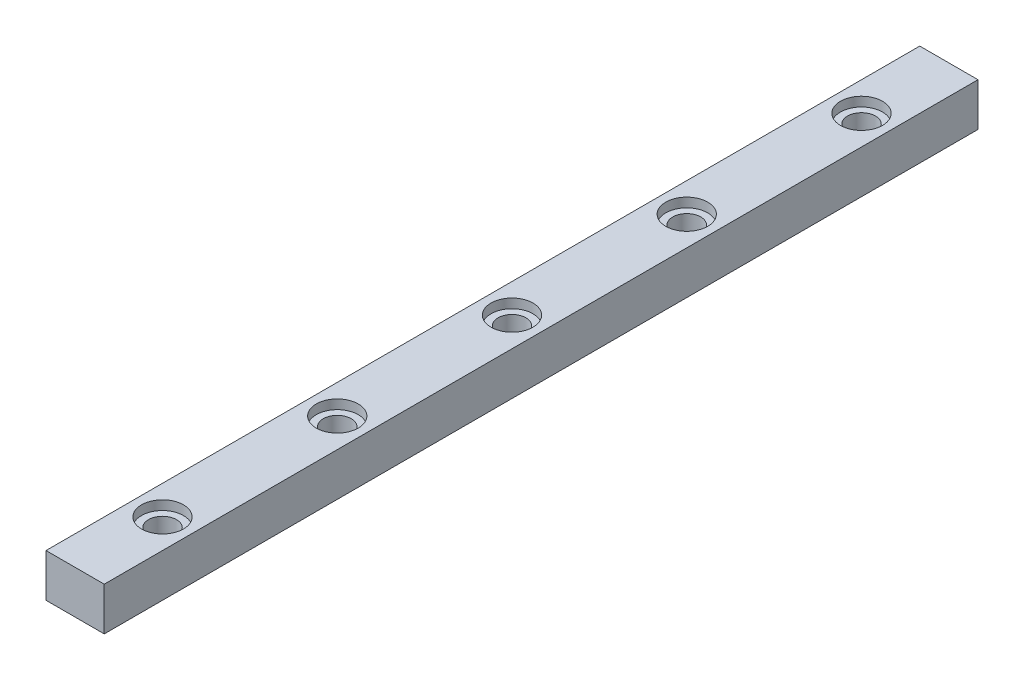
from build123d import *

# Parameters (mm, degrees)
SKETCH_1_W             = 5
SKETCH_1_H             = 3.7
EXTRUDE_1_DEPTH        = 37.5
SKETCH_2_R             = 1.2
CUT_EXTRUDE_1_DEPTH    = 3010.5
SKETCH_3_R             = 1.8
CUT_EXTRUDE_2_DEPTH    = 0.8
PATTERN_LINEAR_1_COUNT = 5
PATTERN_LINEAR_1_PITCH = 15


with BuildPart() as part:
    # 草图1 → 凸台-拉伸1 (new, symmetric)
    with BuildSketch(Plane.XY):
        Rectangle(SKETCH_1_W, SKETCH_1_H)
    extrude(amount=EXTRUDE_1_DEPTH, both=True)

    # 草图2 → 切除-拉伸1 (cut, symmetric)
    with BuildSketch(Plane(origin=(0, 1.85, 0), x_dir=(1, 0, 0), z_dir=(0, 1, 0))):
        with Locations(Location((0, -30, 0), (0, 0, 270))):
            Circle(SKETCH_2_R)
    cut_extrude_1 = extrude(amount=CUT_EXTRUDE_1_DEPTH, both=True, mode=Mode.SUBTRACT)

    # 草图3 → 切除-拉伸2 (cut)
    with BuildSketch(Plane(origin=(0, 1.85, 0), x_dir=(1, 0, 0), z_dir=(0, 1, 0))):
        with Locations(Location((0, -30, 0), (0, 0, 270))):
            Circle(SKETCH_3_R)
    cut_extrude_2 = extrude(amount=-CUT_EXTRUDE_2_DEPTH, mode=Mode.SUBTRACT)

    # 阵列(线性)1: 切除-拉伸1, 切除-拉伸2 ×5
    with Locations(*[(0, 0, -i * PATTERN_LINEAR_1_PITCH) for i in range(1, PATTERN_LINEAR_1_COUNT)]):
        add(cut_extrude_1, mode=Mode.SUBTRACT)
        add(cut_extrude_2, mode=Mode.SUBTRACT)


solid = part.part
